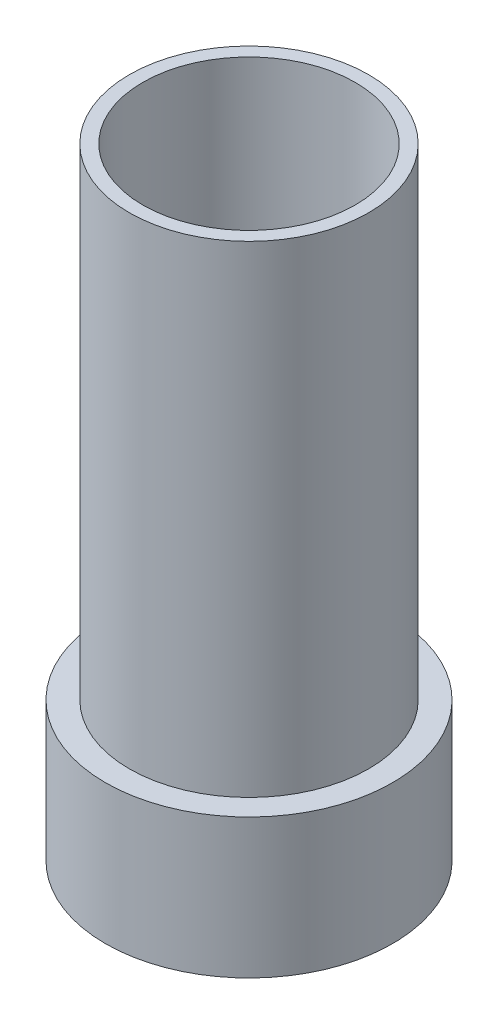
from build123d import *

# Parameters (mm, degrees)
SKETCH1_R           = 7.9375
SKETCH1_R_2         = 7.0485
BOSS_EXTRUDE1_DEPTH = 41.2
SKETCH2_R           = 9.525
SKETCH2_R_2         = 7.9375
BOSS_EXTRUDE2_DEPTH = 9.25


with BuildPart() as part:
    # Sketch1 → Boss-Extrude1 (new body)
    with BuildSketch(Plane(origin=(0, 0, 0), x_dir=(1, 0, 0), z_dir=(0, 1, 0))):
        with Locations(Location((13.632659162, 6.079429086, 0), (0, 0, 90))):
            Circle(SKETCH1_R)
        with Locations(Location((13.632659162, 6.079429086, 0), (0, 0, 90))):
            Circle(SKETCH1_R_2, mode=Mode.SUBTRACT)
    extrude(amount=BOSS_EXTRUDE1_DEPTH)

    # Sketch2 → Boss-Extrude2 (add)
    with BuildSketch(Plane.XZ):
        with Locations(Location((13.632659162, -6.079429086, 0), (0, 0, 270))):
            Circle(SKETCH2_R)
        with Locations(Location((13.632659162, -6.079429086, 0), (0, 0, 270))):
            Circle(SKETCH2_R_2, mode=Mode.SUBTRACT)
    extrude(amount=-BOSS_EXTRUDE2_DEPTH)


solid = part.part
